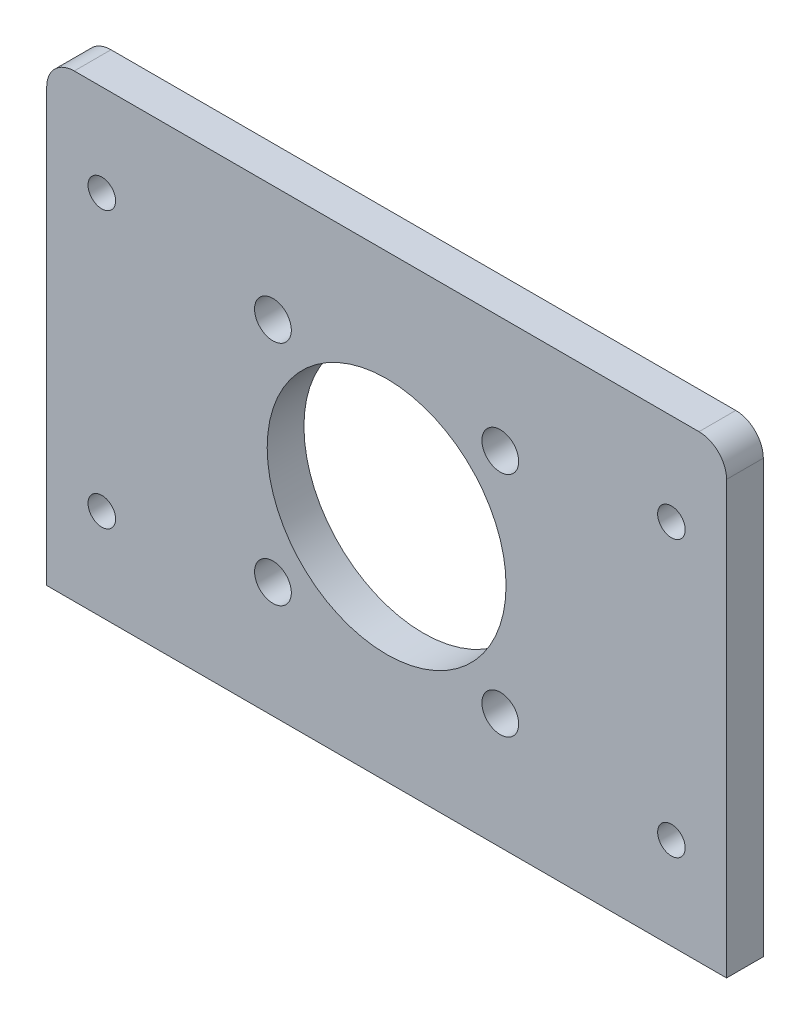
from build123d import *

# Parameters (mm, degrees)
SKETCH_1_W            = 74
SKETCH_1_H            = 50
EXTRUDE_1_DEPTH       = 4
SKETCH_2_R            = 13
CUT_EXTRUDE_1_DEPTH   = 45.833023543
CUT_EXTRUDE_2_DEPTH   = 45.833023543
MIRROR_2_COPY_1_DEPTH = 45.833023543
CUT_EXTRUDE_3_DEPTH   = 45.833023543
MIRROR_4_COPY_1_DEPTH = 45.833023543
FILLET_2_R            = 3


with BuildPart() as part:
    # 草图1 → 凸台-拉伸1 (new body)
    with BuildSketch(Plane.XY):
        Rectangle(SKETCH_1_W, SKETCH_1_H)
    extrude(amount=EXTRUDE_1_DEPTH)

    # 草图2 → 切除-拉伸1 (cut, through all)
    with BuildSketch(Plane.XY.offset(4)):
        Circle(SKETCH_2_R)
    extrude(amount=-CUT_EXTRUDE_1_DEPTH, mode=Mode.SUBTRACT)

    # 草图3 → 切除-拉伸2 (cut, through all)
    with BuildSketch(Plane.XY.offset(4)):
        with BuildLine():
            ThreePointArc((10.374368671, 12.374368671), (10.960155108, 10.960155108), (12.374368671, 10.374368671))
            Line((12.374368671, 10.374368671), (12.374368671, 12.374368671))
            Line((12.374368671, 12.374368671), (10.374368671, 12.374368671))
        make_face()
        with BuildLine():
            Line((12.374368671, 12.374368671), (12.374368671, 10.374368671))
            ThreePointArc((12.374368671, 10.374368671), (13.788582233, 10.960155108), (14.374368671, 12.374368671))
            ThreePointArc((14.374368671, 12.374368671), (12.374368671, 14.374368671), (10.374368671, 12.374368671))
            Line((10.374368671, 12.374368671), (12.374368671, 12.374368671))
        make_face()
    cut_extrude_2 = extrude(amount=-CUT_EXTRUDE_2_DEPTH, mode=Mode.SUBTRACT)

    # 镜向1: 切除-拉伸2 across plane
    add(cut_extrude_2.mirror(Plane(origin=(0, 0, 0), x_dir=(0, 0, 1), z_dir=(1, 0, 0))), mode=Mode.SUBTRACT)

    # 镜向2: 切除-拉伸2 across plane
    add(cut_extrude_2.mirror(Plane.ZX), mode=Mode.SUBTRACT)

    # 镜向2 copy 1 sketch → 镜向2 copy 1 (cut, through all)
    with BuildSketch(Plane(origin=(0, 0, 4), x_dir=(-1, 0, 0), z_dir=(0, 0, 1))):
        with BuildLine():
            ThreePointArc((10.374368671, 12.374368671), (10.960155108, 10.960155108), (12.374368671, 10.374368671))
            Line((12.374368671, 10.374368671), (12.374368671, 12.374368671))
            Line((12.374368671, 12.374368671), (10.374368671, 12.374368671))
        make_face()
        with BuildLine():
            Line((12.374368671, 12.374368671), (12.374368671, 10.374368671))
            ThreePointArc((12.374368671, 10.374368671), (13.788582233, 10.960155108), (14.374368671, 12.374368671))
            ThreePointArc((14.374368671, 12.374368671), (12.374368671, 14.374368671), (10.374368671, 12.374368671))
            Line((10.374368671, 12.374368671), (12.374368671, 12.374368671))
        make_face()
    extrude(amount=-MIRROR_2_COPY_1_DEPTH, mode=Mode.SUBTRACT)

    # 草图4 → 切除-拉伸3 (cut, through all)
    with BuildSketch(Plane.XY.offset(4)):
        with BuildLine():
            ThreePointArc((-29.5, 15), (-32.060660172, 16.060660172), (-31, 13.5))
            Line((-31, 13.5), (-31, 15))
            Line((-31, 15), (-29.5, 15))
        make_face()
        with BuildLine():
            Line((-31, 15), (-31, 13.5))
            ThreePointArc((-31, 13.5), (-29.939339828, 13.939339828), (-29.5, 15))
            Line((-29.5, 15), (-31, 15))
        make_face()
    cut_extrude_3 = extrude(amount=-CUT_EXTRUDE_3_DEPTH, mode=Mode.SUBTRACT)

    # 镜向3: 切除-拉伸3 across plane
    add(cut_extrude_3.mirror(Plane(origin=(0, 0, 0), x_dir=(0, 0, 1), z_dir=(1, 0, 0))), mode=Mode.SUBTRACT)

    # 镜向4: 切除-拉伸3 across plane
    add(cut_extrude_3.mirror(Plane.ZX), mode=Mode.SUBTRACT)

    # 镜向4 copy 1 sketch → 镜向4 copy 1 (cut, through all)
    with BuildSketch(Plane(origin=(0, 0, 4), x_dir=(-1, 0, 0), z_dir=(0, 0, 1))):
        with BuildLine():
            ThreePointArc((-29.5, 15), (-32.060660172, 16.060660172), (-31, 13.5))
            Line((-31, 13.5), (-31, 15))
            Line((-31, 15), (-29.5, 15))
        make_face()
        with BuildLine():
            Line((-31, 15), (-31, 13.5))
            ThreePointArc((-31, 13.5), (-29.939339828, 13.939339828), (-29.5, 15))
            Line((-29.5, 15), (-31, 15))
        make_face()
    extrude(amount=-MIRROR_4_COPY_1_DEPTH, mode=Mode.SUBTRACT)

    # 圆角2
    fillet_2_edges = [part.edges().sort_by_distance(p)[0] for p in [
        (-37, 25, 2),
        (37, 25, 2),
    ]]
    fillet(fillet_2_edges, radius=FILLET_2_R)


solid = part.part
